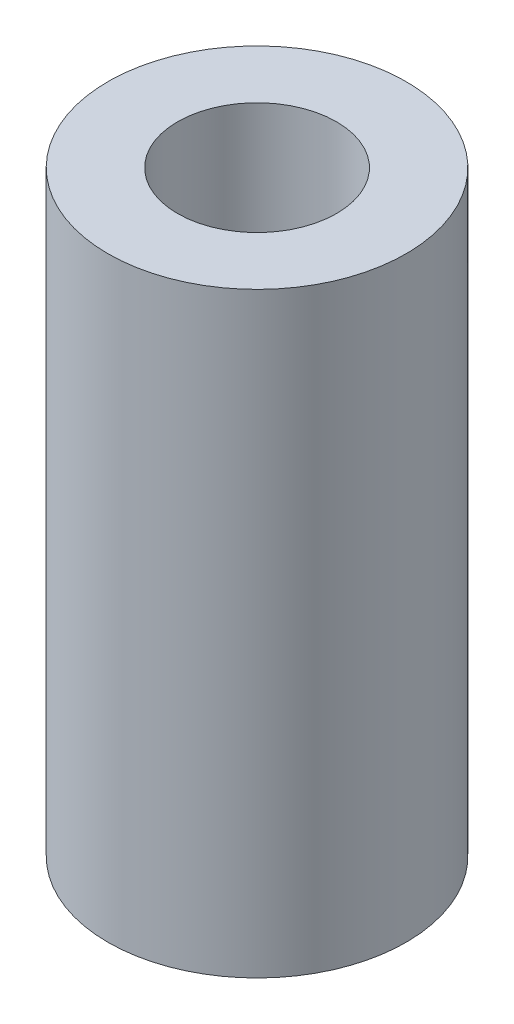
from build123d import *

# Parameters (mm, degrees)
SKETCH1_R           = 15
SKETCH1_R_2         = 8
BOSS_EXTRUDE1_DEPTH = 30


with BuildPart() as part:
    # Sketch1 → Boss-Extrude1 (new, symmetric)
    with BuildSketch(Plane(origin=(0, 0, 0), x_dir=(1, 0, 0), z_dir=(0, 1, 0))):
        with Locations(Location((0, 0, 0), (0, 0, 270))):
            Circle(SKETCH1_R)
        with Locations(Location((0, 0, 0), (0, 0, 270))):
            Circle(SKETCH1_R_2, mode=Mode.SUBTRACT)
    extrude(amount=BOSS_EXTRUDE1_DEPTH, both=True)


solid = part.part
